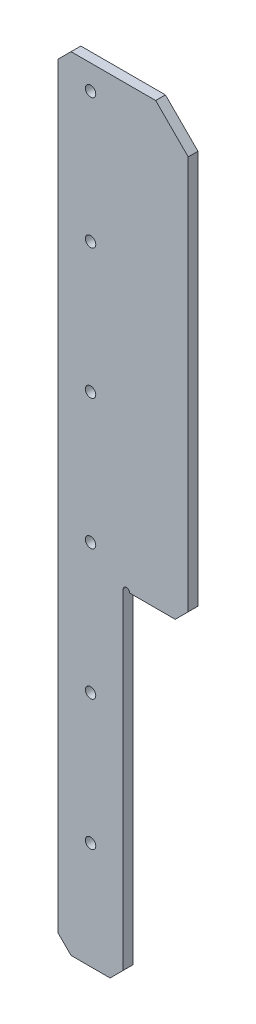
from build123d import *

# Parameters (mm, degrees)
EXTRUDE_1_DEPTH        = 1.5
SKETCH_2_R             = 1.6
CUT_EXTRUDE_1_DEPTH    = 137.506410106
PATTERN_LINEAR_1_COUNT = 6
PATTERN_LINEAR_1_PITCH = 40
CHAMFER_1_SIZE         = 10
CHAMFER_2_SIZE         = 4
SKETCH_3_R             = 1
CUT_EXTRUDE_2_DEPTH    = 137.506410106


with BuildPart() as part:
    # 草图1 → 凸台-拉伸1 (new, symmetric)
    with BuildSketch(Plane.XY):
        Polygon((-20, 135), (-20, -105.4), (0, -105.4), (0, 0), (20, 0), (20, 135), align=None)
    extrude(amount=EXTRUDE_1_DEPTH, both=True)

    # 草图2 → 切除-拉伸1 (cut, through all)
    with BuildSketch(Plane.XY.offset(1.5)):
        with Locations((-10, 127.5)):
            Circle(SKETCH_2_R)
    cut_extrude_1 = extrude(amount=-CUT_EXTRUDE_1_DEPTH, mode=Mode.SUBTRACT)

    # 阵列(线性)1: 切除-拉伸1 ×6
    with Locations(*[(0, -i * PATTERN_LINEAR_1_PITCH, 0) for i in range(1, PATTERN_LINEAR_1_COUNT)]):
        add(cut_extrude_1, mode=Mode.SUBTRACT)

    # 倒角1
    chamfer_1_edges = [part.edges().sort_by_distance(p)[0] for p in [
        (20, 135, 0),
    ]]
    chamfer(chamfer_1_edges, length=CHAMFER_1_SIZE)

    # 倒角2
    chamfer_2_edges = [part.edges().sort_by_distance(p)[0] for p in [
        (20, 0, 0),
        (0, -105.4, 0),
        (-20, -105.4, 0),
        (-20, 135, 0),
    ]]
    chamfer(chamfer_2_edges, length=CHAMFER_2_SIZE)

    # 草图3 → 切除-拉伸2 (cut, through all)
    with BuildSketch(Plane.XY.offset(1.5)):
        with Locations((1, 0)):
            Circle(SKETCH_3_R)
    extrude(amount=-CUT_EXTRUDE_2_DEPTH, mode=Mode.SUBTRACT)


solid = part.part
